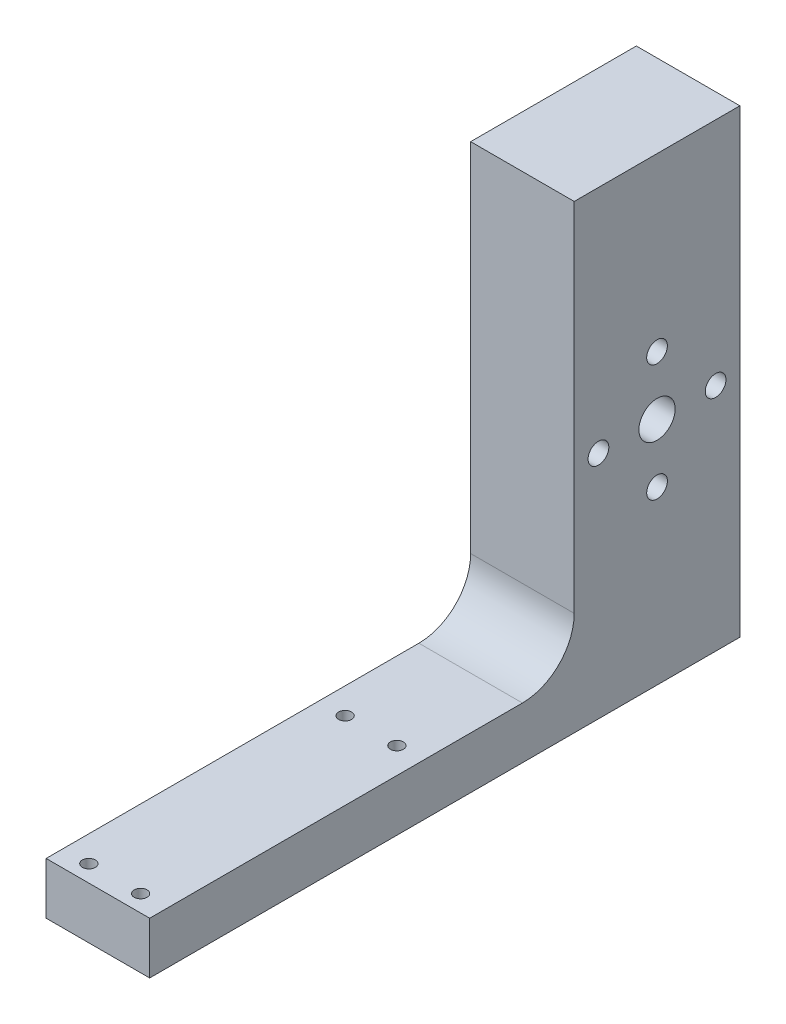
from build123d import *

# Parameters (mm, degrees)
SKETCH1_W           = 20
SKETCH1_H           = 82
SKETCH1_R           = 1.25
BOSS_EXTRUDE1_DEPTH = 10
SKETCH2_W           = 20
SKETCH2_H           = 88.9
BOSS_EXTRUDE2_DEPTH = 32
FILLET1_R           = 10
SKETCH3_R           = 2
SKETCH3_R_2         = 3.5
CUT_EXTRUDE1_DEPTH  = 32


with BuildPart() as part:
    # Sketch1 → Boss-Extrude1 (new body)
    with BuildSketch(Plane(origin=(0, 0, 0), x_dir=(1, 0, 0), z_dir=(0, 1, 0))):
        with Locations((10, 35)):
            Rectangle(SKETCH1_W, SKETCH1_H)
        with Locations(Location((5, 46.75, 0), (0, 0, 270))):
            Circle(SKETCH1_R, mode=Mode.SUBTRACT)
        with Locations(Location((15, 46.75, 0), (0, 0, 270))):
            Circle(SKETCH1_R, mode=Mode.SUBTRACT)
        with Locations(Location((5, -2.75, 0), (0, 0, 270))):
            Circle(SKETCH1_R, mode=Mode.SUBTRACT)
        with Locations(Location((15, -2.75, 0), (0, 0, 270))):
            Circle(SKETCH1_R, mode=Mode.SUBTRACT)
    extrude(amount=BOSS_EXTRUDE1_DEPTH)

    # Sketch2 → Boss-Extrude2 (add)
    with BuildSketch(Plane(origin=(0, 0, -76), x_dir=(-1, 0, 0), z_dir=(0, 0, -1))):
        with Locations((-10, 44.45)):
            Rectangle(SKETCH2_W, SKETCH2_H)
    extrude(amount=BOSS_EXTRUDE2_DEPTH)

    # Fillet1
    fillet1_edges = [part.edges().sort_by_distance(p)[0] for p in [
        (10, 10, -76),
    ]]
    fillet(fillet1_edges, radius=FILLET1_R)

    # Sketch3 → Cut-Extrude1 (cut)
    with BuildSketch(Plane(origin=(20, 0, 0), x_dir=(0, 0, -1), z_dir=(1, 0, 0))):
        with Locations((92, 33.136291501)):
            Circle(SKETCH3_R)
        with Locations((103.313708499, 44.45)):
            Circle(SKETCH3_R)
        with Locations((80.686291501, 44.45)):
            Circle(SKETCH3_R)
        with Locations((92, 55.763708499)):
            Circle(SKETCH3_R)
        with Locations((92, 44.45)):
            Circle(SKETCH3_R_2)
    extrude(amount=-CUT_EXTRUDE1_DEPTH, mode=Mode.SUBTRACT)


solid = part.part
